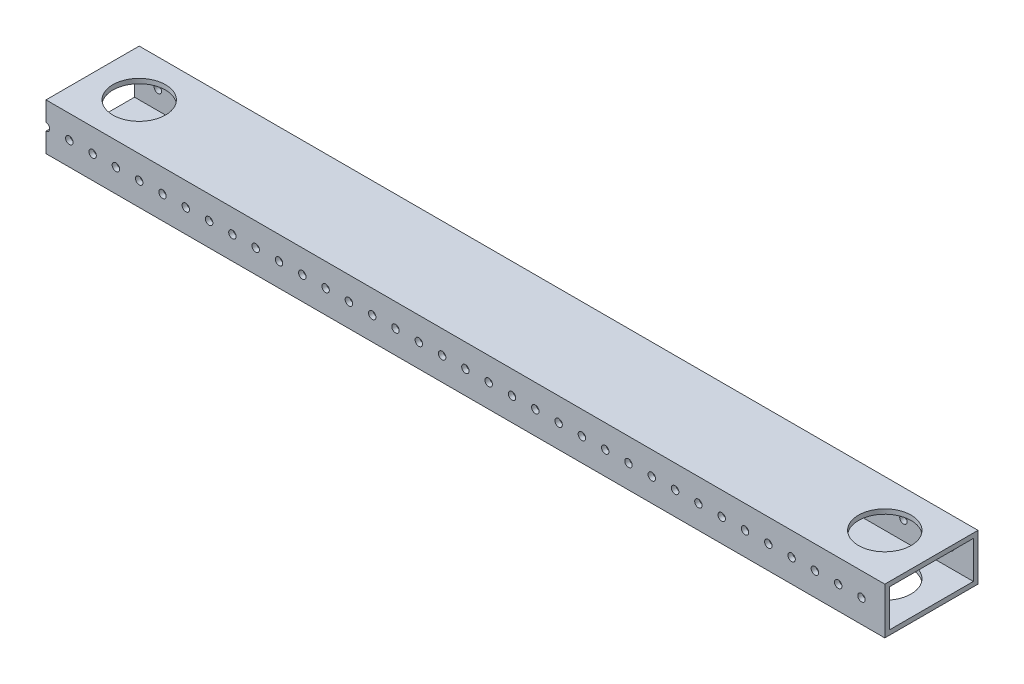
from build123d import *

# Parameters (mm, degrees)
SKETCH1_W           = 50.8
SKETCH1_H           = 25.4
SKETCH1_W_2         = 45.72
SKETCH1_H_2         = 20.32
BOSS_EXTRUDE1_DEPTH = 228.6
SKETCH3_R           = 14.351
CUT_EXTRUDE2_DEPTH  = 232.40501291
SKETCH4_R           = 2.032
CUT_EXTRUDE3_DEPTH  = 235.52055347


with BuildPart() as part:
    # Sketch1 → Boss-Extrude1 (new, symmetric)
    with BuildSketch(Plane(origin=(0, 0, 0), x_dir=(0, 0, -1), z_dir=(1, 0, 0))):
        Rectangle(SKETCH1_W, SKETCH1_H)
        Rectangle(SKETCH1_W_2, SKETCH1_H_2, mode=Mode.SUBTRACT)
    extrude(amount=BOSS_EXTRUDE1_DEPTH, both=True)

    # Sketch3 → Cut-Extrude2 (cut, through all)
    with BuildSketch(Plane.XZ.offset(12.7)):
        with Locations(Location((203.2, 0, 0), (0, 0, 270))):
            Circle(SKETCH3_R)
        with Locations(Location((-203.2, 0, 0), (0, 0, 270))):
            Circle(SKETCH3_R)
    extrude(amount=-CUT_EXTRUDE2_DEPTH, mode=Mode.SUBTRACT)

    # Sketch4 → Cut-Extrude3 (cut, through all)
    with BuildSketch(Plane(origin=(0, 0, -25.4), x_dir=(-1, 0, 0), z_dir=(0, 0, -1))):
        with Locations((-215.9, 0)):
            Circle(SKETCH4_R)
        with Locations((-203.2, 0)):
            Circle(SKETCH4_R)
        with Locations((-190.5, 0)):
            Circle(SKETCH4_R)
        with Locations((-177.8, 0)):
            Circle(SKETCH4_R)
        with Locations((-165.1, 0)):
            Circle(SKETCH4_R)
        with Locations((-152.4, 0)):
            Circle(SKETCH4_R)
        with Locations((-139.7, 0)):
            Circle(SKETCH4_R)
        with Locations((-127, 0)):
            Circle(SKETCH4_R)
        with Locations((-114.3, 0)):
            Circle(SKETCH4_R)
        with Locations((-101.6, 0)):
            Circle(SKETCH4_R)
        with Locations((-88.9, 0)):
            Circle(SKETCH4_R)
        with Locations((-76.2, 0)):
            Circle(SKETCH4_R)
        with Locations((-63.5, 0)):
            Circle(SKETCH4_R)
        with Locations((-50.8, 0)):
            Circle(SKETCH4_R)
        with Locations((-38.1, 0)):
            Circle(SKETCH4_R)
        with Locations((-25.4, 0)):
            Circle(SKETCH4_R)
        with Locations((-12.7, 0)):
            Circle(SKETCH4_R)
        Circle(SKETCH4_R)
        with Locations((12.7, 0)):
            Circle(SKETCH4_R)
        with Locations((25.4, 0)):
            Circle(SKETCH4_R)
        with Locations((38.1, 0)):
            Circle(SKETCH4_R)
        with Locations((50.8, 0)):
            Circle(SKETCH4_R)
        with Locations((63.5, 0)):
            Circle(SKETCH4_R)
        with Locations((76.2, 0)):
            Circle(SKETCH4_R)
        with Locations((88.9, 0)):
            Circle(SKETCH4_R)
        with Locations((101.6, 0)):
            Circle(SKETCH4_R)
        with Locations((114.3, 0)):
            Circle(SKETCH4_R)
        with Locations((127, 0)):
            Circle(SKETCH4_R)
        with Locations((139.7, 0)):
            Circle(SKETCH4_R)
        with Locations((152.4, 0)):
            Circle(SKETCH4_R)
        with Locations((165.1, 0)):
            Circle(SKETCH4_R)
        with Locations((177.8, 0)):
            Circle(SKETCH4_R)
        with Locations((190.5, 0)):
            Circle(SKETCH4_R)
        with Locations((203.2, 0)):
            Circle(SKETCH4_R)
        with Locations((215.9, 0)):
            Circle(SKETCH4_R)
        with Locations((228.6, 0)):
            Circle(SKETCH4_R)
    extrude(amount=-CUT_EXTRUDE3_DEPTH, mode=Mode.SUBTRACT)


solid = part.part
